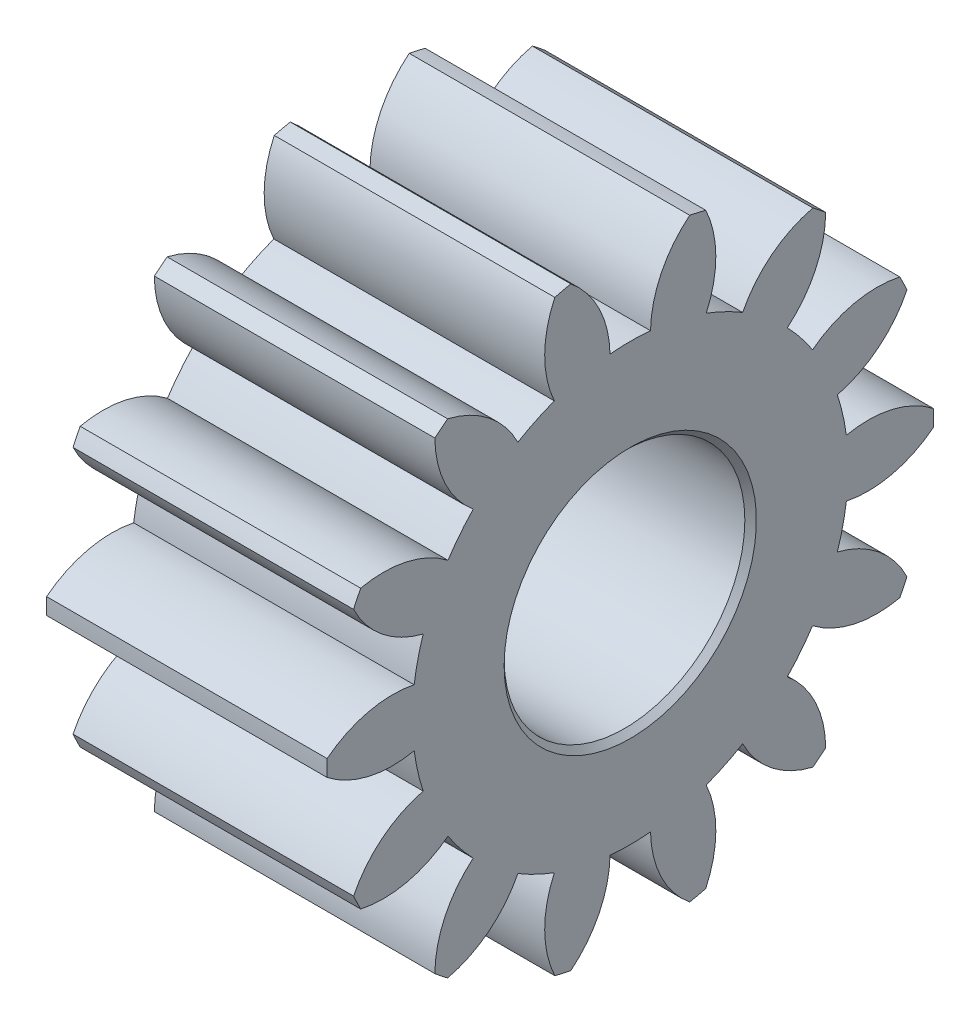
from build123d import *

# Parameters (mm, degrees)
BASPROSKE_W     = 37
BASPROSKE_H     = 40
TOOTHCUT_DEPTH  = 68.594378464
TEETHCUTS_COUNT = 14
TEETHCUTS_ANGLE = 334.285714286
BORSKE_R        = 15.875
BORE_DEPTH      = 50.000508
CHAMFER1_SIZE   = 0.762


with BuildPart() as part:
    # BasProSke → Base-Revolve (revolve)
    with BuildSketch(Plane(origin=(0, 0, 0), x_dir=(1, 0, 0), z_dir=(0, 1, 0)), mode=Mode.PRIVATE) as base_revolve_sk:
        with Locations((18.5, 20)):
            Rectangle(BASPROSKE_W, BASPROSKE_H)
    revolve(base_revolve_sk.sketch.rotate(Axis((-10, 0, 0), (1, 0, 0)), 180), axis=Axis((-10, 0, 0), (1, 0, 0)))

    # TooCutSke → ToothCut (cut, through all)
    with BuildSketch(Plane(origin=(0, 0, 0), x_dir=(0, 0, -1), z_dir=(1, 0, 0))):
        with BuildLine():
            ThreePointArc((2.668955068, 28.624843752), (0, 28.749), (-2.668955068, 28.624843752))
            ThreePointArc((-2.668955068, 28.624843752), (-4.15928171, 34.644525037), (-8.103646746, 39.429879856))
            ThreePointArc((-8.103646746, 39.429879856), (0, 40.254), (8.103646746, 39.429879856))
            ThreePointArc((8.103646746, 39.429879856), (4.15928171, 34.644525037), (2.668955068, 28.624843752))
        make_face()
    toothcut = extrude(amount=TOOTHCUT_DEPTH, mode=Mode.SUBTRACT)

    # TeethCuts: ToothCut ×14 about axis
    teethcuts_axis = Axis((-10, 0, 0), (1, 0, 0))
    for i in range(1, TEETHCUTS_COUNT):
        add(toothcut.rotate(teethcuts_axis, i * TEETHCUTS_ANGLE / (TEETHCUTS_COUNT - 1)), mode=Mode.SUBTRACT)

    # BorSke → Bore (cut, symmetric)
    with BuildSketch(Plane(origin=(0, 0, 0), x_dir=(0, 0, -1), z_dir=(1, 0, 0))):
        with Locations(Location((0, 0, 0), (0, 0, 180))):
            Circle(BORSKE_R)
    extrude(amount=BORE_DEPTH, both=True, mode=Mode.SUBTRACT)

    # Chamfer1
    chamfer1_edges = [part.edges().sort_by_distance(p)[0] for p in [
        (37, 0, -15.875),
        (0, 0, -15.875),
    ]]
    chamfer(chamfer1_edges, length=CHAMFER1_SIZE)


solid = part.part
